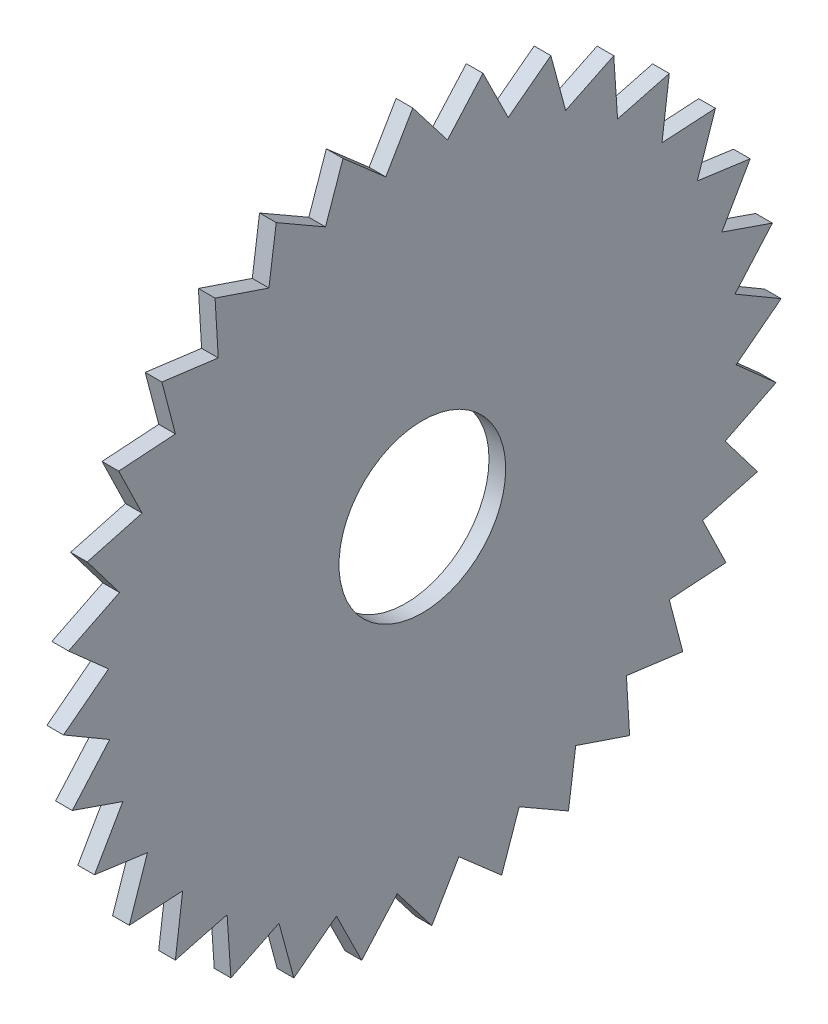
from build123d import *

# Parameters (mm, degrees)
SKETCH1_R           = 45
BOSS_EXTRUDE1_DEPTH = 2
CUT_EXTRUDE2_DEPTH  = 64.671029519
CIRPATTERN1_COUNT   = 32
SKETCH4_R           = 10
CUT_EXTRUDE3_DEPTH  = 10


with BuildPart() as part:
    # Sketch1 → Boss-Extrude1 (new body)
    with BuildSketch(Plane(origin=(0, 0, 0), x_dir=(0, 0, -1), z_dir=(1, 0, 0))):
        Circle(SKETCH1_R)
    extrude(amount=BOSS_EXTRUDE1_DEPTH)

    # Sketch3 → Cut-Extrude2 (cut, symmetric)
    with BuildSketch(Plane(origin=(2, 0, 0), x_dir=(0, 0, -1), z_dir=(1, 0, 0))):
        Polygon((111.061055433, 234.770812069), (0, 45), (-4.384441822, 37.508273204), (-11.303681047, 43.557166974), (-176.845255951, 188.275880779), (-246.955404965, 622.412545429), (40.950906418, 668.907476719), align=None)
    cut_extrude2 = extrude(amount=CUT_EXTRUDE2_DEPTH, both=True, mode=Mode.SUBTRACT)

    # CirPattern1: Cut-Extrude2 ×32 about axis
    cirpattern1_axis = Axis((2, 0, 0), (-1, 0, 0))
    for i in range(1, CIRPATTERN1_COUNT):
        add(cut_extrude2.rotate(cirpattern1_axis, i * 360 / CIRPATTERN1_COUNT), mode=Mode.SUBTRACT)

    # Sketch4 → Cut-Extrude3 (cut)
    with BuildSketch(Plane(origin=(2, 0, 0), x_dir=(0, 0, -1), z_dir=(1, 0, 0))):
        Circle(SKETCH4_R)
    extrude(amount=-CUT_EXTRUDE3_DEPTH, mode=Mode.SUBTRACT)


solid = part.part
